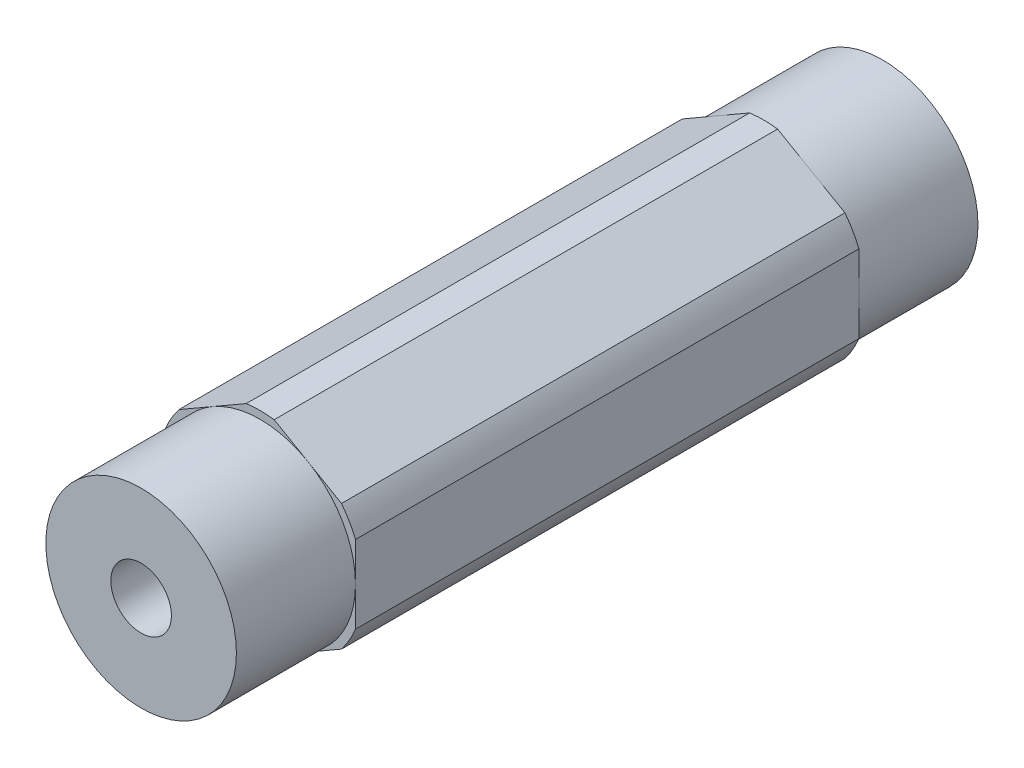
from build123d import *

# Parameters (mm, degrees)
BOSS_EXTRUDE1_DEPTH                  = 16.77543
SKETCH4_R                            = 6.35
BOSS_EXTRUDE2_DEPTH                  = 7.9375
F_10_32_TAPPED_HOLE1_D               = 4.0386
F_10_32_TAPPED_HOLE1_DEPTH           = 12.02944
F_10_32_TAPPED_HOLE1_TIP             = 1.213317848
F_10_32_TAPPED_HOLE1_ON_FACE_2_D     = 4.0386
F_10_32_TAPPED_HOLE1_ON_FACE_2_DEPTH = 12.02944
F_10_32_TAPPED_HOLE1_ON_FACE_2_TIP   = 1.213317848


with BuildPart() as part:
    # Sketch1 → Boss-Extrude1 (new, symmetric)
    with BuildSketch(Plane.XY):
        with BuildLine():
            ThreePointArc((0.93173274, 6.79441227), (0, 6.858), (-0.93173274, 6.79441227))
            Line((-0.93173274, 6.79441227), (-5.41826726, 4.204110358))
            ThreePointArc((-5.41826726, 4.204110358), (-5.939202219, 3.429), (-6.35, 2.590301913))
            Line((-6.35, 2.590301913), (-6.35, -2.590301913))
            ThreePointArc((-6.35, -2.590301913), (-5.939202219, -3.429), (-5.41826726, -4.204110358))
            Line((-5.41826726, -4.204110358), (-0.93173274, -6.79441227))
            ThreePointArc((-0.93173274, -6.79441227), (0, -6.858), (0.93173274, -6.79441227))
            Line((0.93173274, -6.79441227), (5.41826726, -4.204110358))
            ThreePointArc((5.41826726, -4.204110358), (5.939202219, -3.429), (6.35, -2.590301913))
            Line((6.35, -2.590301913), (6.35, 2.590301913))
            ThreePointArc((6.35, 2.590301913), (5.939202219, 3.429), (5.41826726, 4.204110358))
            Line((5.41826726, 4.204110358), (0.93173274, 6.79441227))
        make_face()
    extrude(amount=BOSS_EXTRUDE1_DEPTH, both=True)

    # Sketch4 → Boss-Extrude2 (add)
    with BuildSketch(Plane.XY.offset(16.77543)):
        Circle(SKETCH4_R)
    boss_extrude2 = extrude(amount=BOSS_EXTRUDE2_DEPTH)

    # Mirror1: Boss-Extrude2 across plane
    add(boss_extrude2.mirror(Plane.XY))

    # #10-32 Tapped Hole1
    with Locations(Plane.XY.offset(24.71293)):
        with Locations((0, 0)):
            Hole(F_10_32_TAPPED_HOLE1_D / 2, depth=F_10_32_TAPPED_HOLE1_DEPTH)
            with Locations((0, 0, -(F_10_32_TAPPED_HOLE1_DEPTH + F_10_32_TAPPED_HOLE1_TIP / 2))):  # 118° drill point
                Cone(0, F_10_32_TAPPED_HOLE1_D / 2, F_10_32_TAPPED_HOLE1_TIP, mode=Mode.SUBTRACT)

    # #10-32 Tapped Hole1 on face 2
    with Locations(Plane(origin=(0, 0, -24.71293), x_dir=(-1, 0, 0), z_dir=(0, 0, -1))):
        with Locations((0, 0)):
            Hole(F_10_32_TAPPED_HOLE1_ON_FACE_2_D / 2, depth=F_10_32_TAPPED_HOLE1_ON_FACE_2_DEPTH)
            with Locations((0, 0, -(F_10_32_TAPPED_HOLE1_ON_FACE_2_DEPTH + F_10_32_TAPPED_HOLE1_ON_FACE_2_TIP / 2))):  # 118° drill point
                Cone(0, F_10_32_TAPPED_HOLE1_ON_FACE_2_D / 2, F_10_32_TAPPED_HOLE1_ON_FACE_2_TIP, mode=Mode.SUBTRACT)


solid = part.part
